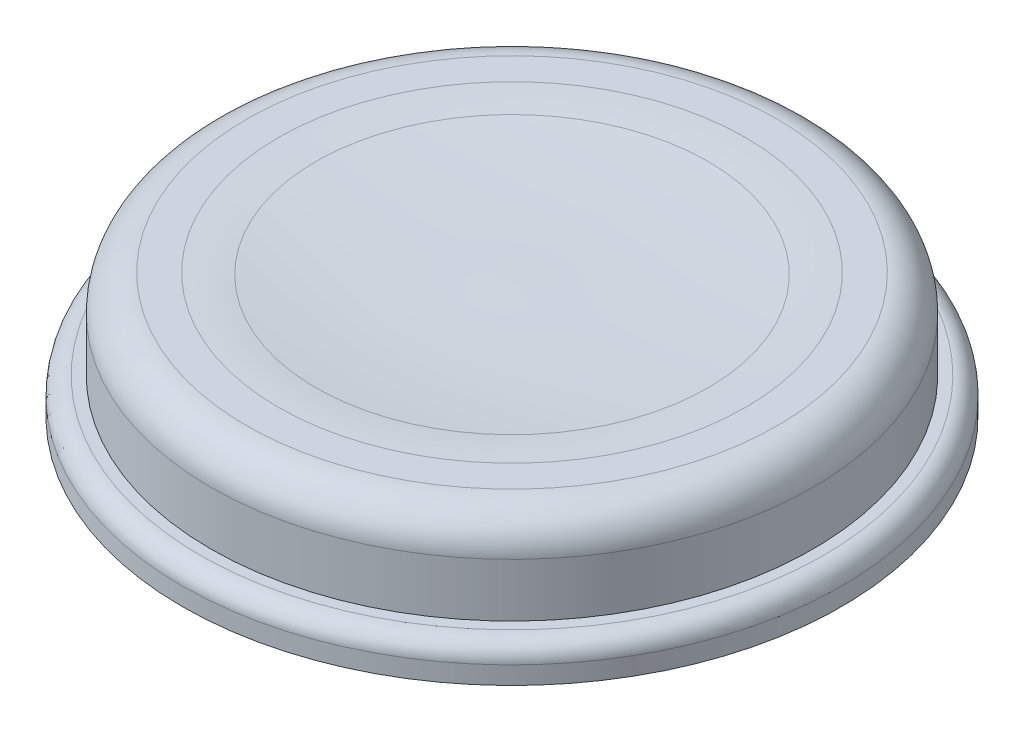
from build123d import *

# Parameters (mm, degrees)
SKETCH3_R           = 4
BOSS_EXTRUDE3_DEPTH = 3.6
FILLET1_R           = 1


with BuildPart() as part:
    # Sketch2 → Revolve1 (revolve)
    with BuildSketch(Plane(origin=(0, 0, 0), x_dir=(0, 0, -1), z_dir=(1, 0, 0)), mode=Mode.PRIVATE) as revolve1_sk:
        with BuildLine():
            Line((-17.5, 0), (-16.9, 0))
            Line((-16.9, 0), (-16.9, 3))
            ThreePointArc((-16.9, 3), (-16.314213562, 4.414213562), (-14.9, 5))
            Line((-14.9, 5), (-13.115625794, 5))
            ThreePointArc((-13.115625794, 5), (-12.059795288, 4.97344087), (-11.006635444, 4.893830661))
            ThreePointArc((-11.006635444, 4.893830661), (-5.509703142, 4.518457948), (0, 4.5))
            Line((0, 4.5), (0, 0))
            Line((0, 0), (-13.5, 0))
            ThreePointArc((-13.5, 0), (-14.207106781, -0.292893219), (-14.5, -1))
            Line((-14.5, -1), (-14.5, -2))
            Line((-14.5, -2), (-18.5, -2))
            Line((-18.5, -2), (-18.5, -1))
            ThreePointArc((-18.5, -1), (-18.207106781, -0.292893219), (-17.5, 0))
        make_face()
    revolve(revolve1_sk.sketch.rotate(Axis((0, 0, 0), (0, 1, 0)), 180), axis=Axis((0, 0, 0), (0, 1, 0)))

    # Sketch3 → Boss-Extrude3 (add)
    with BuildSketch(Plane.XZ):
        with Locations(Location((0, 0, 0), (0, 0, 90))):
            Circle(SKETCH3_R)
    extrude(amount=BOSS_EXTRUDE3_DEPTH)

    # Fillet1
    fillet1_edges = [part.edges().sort_by_distance(p)[0] for p in [
        (0, -3.6, -4),
    ]]
    fillet(fillet1_edges, radius=FILLET1_R)


solid = part.part
